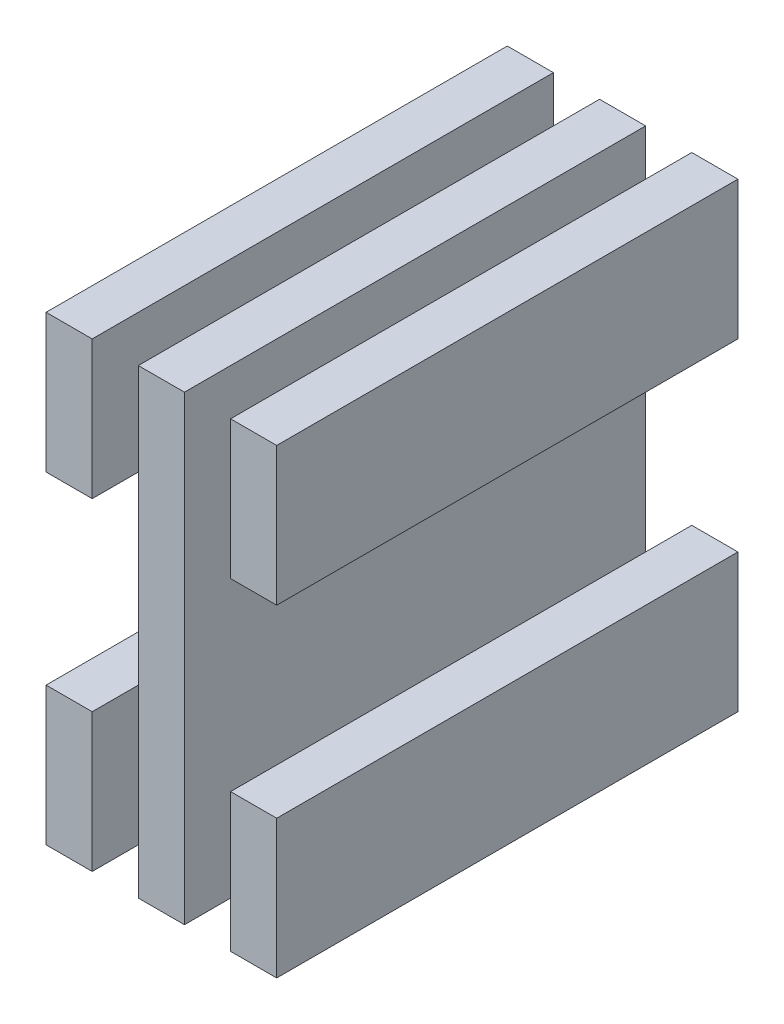
from build123d import *

# Parameters (mm, degrees)
SKETCH1_W             = 5
SKETCH1_H             = 50
BOSS_EXTRUDE1_DEPTH   = 50
BOSS_EXTRUDE1_2_DEPTH = 50
BOSS_EXTRUDE1_3_DEPTH = 50
SKETCH2_W             = 50
SKETCH2_H             = 20
CUT_EXTRUDE1_DEPTH    = 76


with BuildPart() as part:
    # Sketch1 → Boss-Extrude1 (new body)
    with BuildSketch(Plane(origin=(0, 0, 0), x_dir=(1, 0, 0), z_dir=(0, 1, 0))):
        with Locations((12.5, 25)):
            Rectangle(SKETCH1_W, SKETCH1_H)
    extrude(amount=BOSS_EXTRUDE1_DEPTH)


with BuildPart() as body_2:
    # Sketch1 → Boss-Extrude1 2 (new body)
    with BuildSketch(Plane(origin=(0, 0, 0), x_dir=(1, 0, 0), z_dir=(0, 1, 0))):
        with Locations((2.5, 25)):
            Rectangle(SKETCH1_W, SKETCH1_H)
    extrude(amount=BOSS_EXTRUDE1_2_DEPTH)


with BuildPart() as body_3:
    # Sketch1 → Boss-Extrude1 3 (new body)
    with BuildSketch(Plane(origin=(0, 0, 0), x_dir=(1, 0, 0), z_dir=(0, 1, 0))):
        with Locations((22.5, 25)):
            Rectangle(SKETCH1_W, SKETCH1_H)
    extrude(amount=BOSS_EXTRUDE1_3_DEPTH)


with BuildPart() as cut_extrude1_tool:
    # Sketch2 → Cut-Extrude1 (new, through all)
    with BuildSketch(Plane(origin=(25, 0, 0), x_dir=(0, 0, -1), z_dir=(1, 0, 0))):
        with Locations((25, 25)):
            Rectangle(SKETCH2_W, SKETCH2_H)
    extrude(amount=-CUT_EXTRUDE1_DEPTH)


with BuildPart() as body_3_1:
    add(body_3.part)

    # Cut-Extrude1: cut by cut_extrude1_tool
    add(cut_extrude1_tool.part, mode=Mode.SUBTRACT)


with BuildPart() as body_2_1:
    add(body_2.part)

    # Cut-Extrude1: cut by cut_extrude1_tool
    add(cut_extrude1_tool.part, mode=Mode.SUBTRACT)


with BuildPart() as cut_extrude1_piece_1:
    # of the separate pieces the step leaves, piece 1, a body of its own (cut_extrude1_pieces)
    add(body_2_1.part.solids().sort_by_distance((5, 35, 0))[0])


with BuildPart() as cut_extrude1_piece_2:
    # of the separate pieces the step leaves, piece 2, a body of its own (cut_extrude1_pieces)
    add(body_2_1.part.solids().sort_by_distance((0, 0, 0))[0])


with BuildPart() as cut_extrude1_piece_1_of_body_3:
    # of the separate pieces the step leaves, piece 1, a body of its own (cut_extrude1_pieces_of_body_3)
    add(body_3_1.part.solids().sort_by_distance((20, 0, 0))[0])


with BuildPart() as cut_extrude1_piece_2_of_body_3:
    # of the separate pieces the step leaves, piece 2, a body of its own (cut_extrude1_pieces_of_body_3)
    add(body_3_1.part.solids().sort_by_distance((20, 35, 0))[0])


solid = Compound([part.part, cut_extrude1_piece_1.part, cut_extrude1_piece_2.part, cut_extrude1_piece_1_of_body_3.part, cut_extrude1_piece_2_of_body_3.part])
